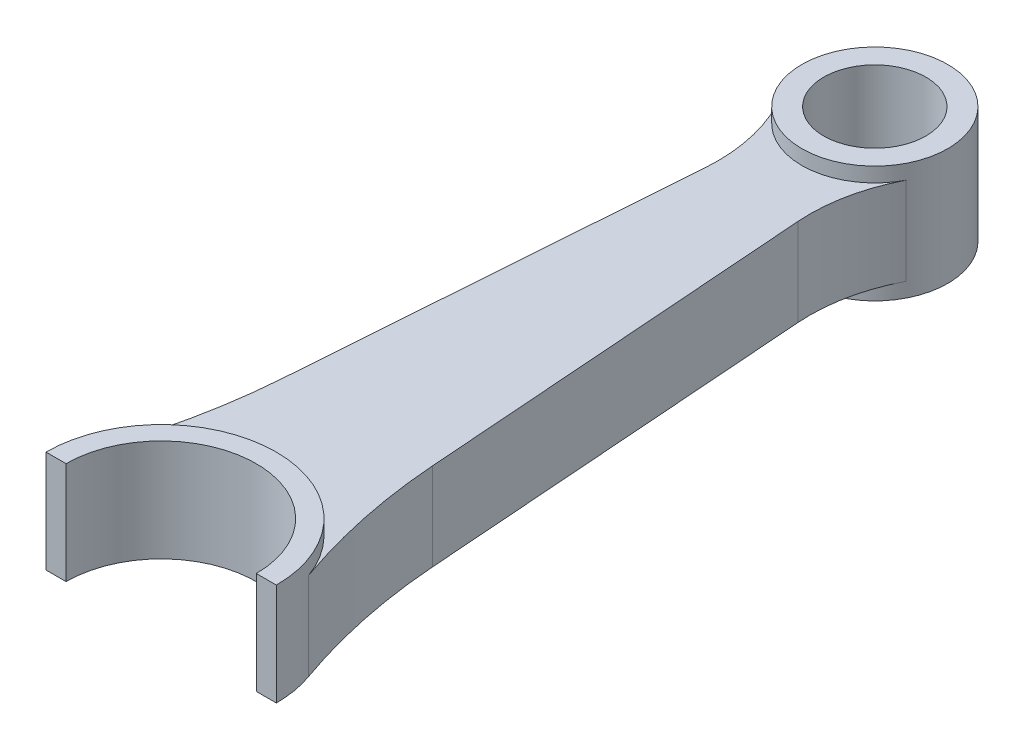
from build123d import *

# Parameters (mm, degrees)
SKETCH_1_R               = 5
SKETCH_1_R_2             = 3.5
EXTRUDE_1_DEPTH          = 4
EXTRUDE_2_DEPTH          = 3
CUT_EXTRUDE_1_DEPTH      = 51.018502827
CUT_EXTRUDE_1_DEPTH_BACK = 51.018502827
EXTRUDE_3_DEPTH          = 1


with BuildPart() as part:
    # 草图1 → 凸台-拉伸1 (new, symmetric)
    with BuildSketch(Plane(origin=(0, 0, 0), x_dir=(1, 0, 0), z_dir=(0, 1, 0))):
        Circle(SKETCH_1_R)
        Circle(SKETCH_1_R_2, mode=Mode.SUBTRACT)
    extrude(amount=EXTRUDE_1_DEPTH, both=True)

    # 草图3 → 凸台-拉伸2 (add, symmetric)
    with BuildSketch(Plane(origin=(0, 0, 0), x_dir=(1, 0, 0), z_dir=(0, 1, 0))):
        with BuildLine():
            ThreePointArc((-4.442907632, -2.293593637), (-3.386405493, -5.288949741), (-3.182744564, -8.45863067))
            Line((-3.182744564, -8.45863067), (-5.166007589, -35.46765597))
            ThreePointArc((-5.166007589, -35.46765597), (-5.938483862, -40.935577384), (-7.435049269, -46.251137201))
            ThreePointArc((-7.435049269, -46.251137201), (-7.775935141, -47.552891453), (-7.890676089, -48.893638195))
            Line((-7.890676089, -48.893638195), (7.890676089, -48.893638195))
            ThreePointArc((7.890676089, -48.893638195), (7.775935141, -47.552891453), (7.435049269, -46.251137201))
            ThreePointArc((7.435049269, -46.251137201), (5.938483862, -40.935577384), (5.166007589, -35.46765597))
            Line((5.166007589, -35.46765597), (3.182744564, -8.45863067))
            ThreePointArc((3.182744564, -8.45863067), (3.386405493, -5.288949741), (4.442907632, -2.293593637))
            ThreePointArc((4.442907632, -2.293593637), (0, -5), (-4.442907632, -2.293593637))
        make_face()
    extrude(amount=EXTRUDE_2_DEPTH, both=True)

    # 草图4 → 切除-拉伸1 (cut, two sides: drawn at the far end of the back side and taken through both)
    with BuildSketch(Plane(origin=(0, 3, 0), x_dir=(1, 0, 0), z_dir=(0, 1, 0)).offset(-CUT_EXTRUDE_1_DEPTH_BACK)):
        with BuildLine():
            Line((-6.517089491, -48.893638195), (6.517089491, -48.893638195))
            ThreePointArc((6.517089491, -48.893638195), (0, -42.376548704), (-6.517089491, -48.893638195))
        make_face()
    extrude(amount=CUT_EXTRUDE_1_DEPTH + CUT_EXTRUDE_1_DEPTH_BACK, mode=Mode.SUBTRACT)

    # 草图5 → 凸台-拉伸3 (add, symmetric)
    with BuildSketch(Plane(origin=(0, 3, 0), x_dir=(1, 0, 0), z_dir=(0, 1, 0))):
        with BuildLine():
            Line((-6.517089491, -48.893638195), (-7.890676089, -48.893638195))
            ThreePointArc((-7.890676089, -48.893638195), (0, -41.002962106), (7.890676089, -48.893638195))
            Line((7.890676089, -48.893638195), (6.517089491, -48.893638195))
            ThreePointArc((6.517089491, -48.893638195), (0, -42.376548704), (-6.517089491, -48.893638195))
        make_face()
    extrude(amount=EXTRUDE_3_DEPTH, both=True)


solid = part.part
